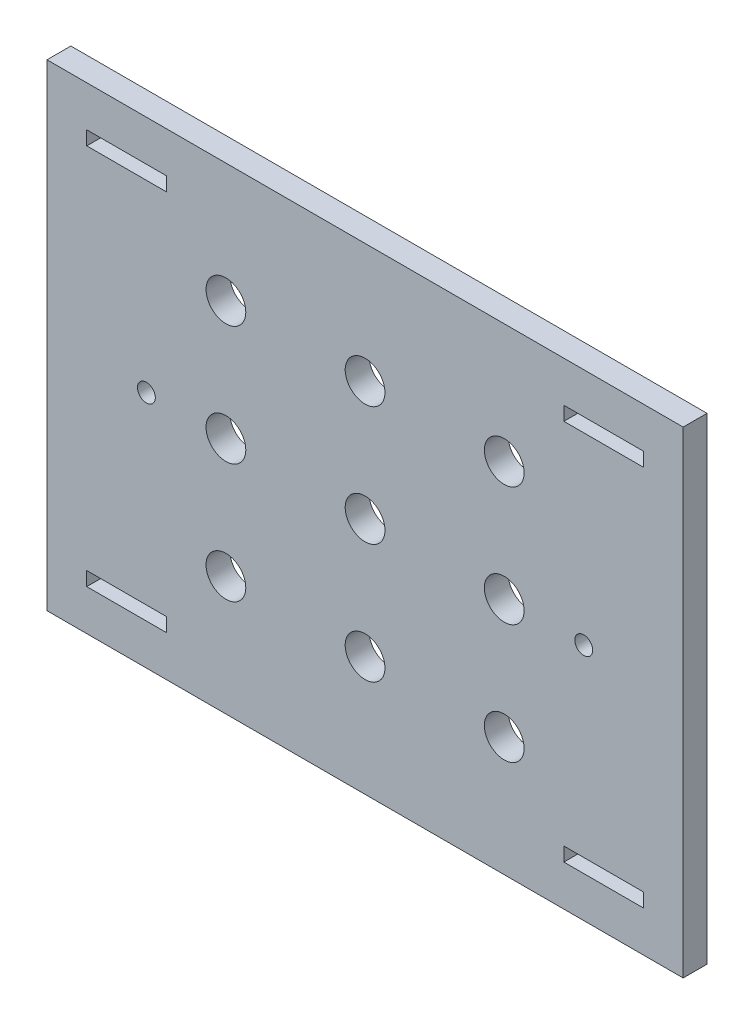
from build123d import *

# Parameters (mm, degrees)
SKETCH_1_W                 = 160
SKETCH_1_H                 = 120
EXTRUDE_160X120_DEPTH      = 6
CUT_EXTRUDE_392_DEPTH      = 101.179838291
CUT_EXTRUDE_392_DEPTH_BACK = 101.179838291
SKETCH_2_R                 = 2.25
SKETCH_2_R_2               = 5
SKETCH_2_W                 = 20
SKETCH_2_H                 = 3.5


with BuildPart() as part:
    # 草图1 → 主板通用托盘160x120 (new body)
    with BuildSketch(Plane.XY):
        Rectangle(SKETCH_1_W, SKETCH_1_H)
    extrude(amount=EXTRUDE_160X120_DEPTH)

    # 草图2 → Cut-Extrude 392 (cut, two sides: drawn at the far end of the back side and taken through both)
    with BuildSketch(Plane.XY.offset(-CUT_EXTRUDE_392_DEPTH_BACK)):
        with Locations((-55, 0)):
            Circle(SKETCH_2_R)
        with Locations((55, 0)):
            Circle(SKETCH_2_R)
        with Locations((-35, -30)):
            Circle(SKETCH_2_R_2)
        with Locations((-35, 0)):
            Circle(SKETCH_2_R_2)
        with Locations((-35, 30)):
            Circle(SKETCH_2_R_2)
        with Locations((0, -30)):
            Circle(SKETCH_2_R_2)
        Circle(SKETCH_2_R_2)
        with Locations((0, 30)):
            Circle(SKETCH_2_R_2)
        with Locations((35, -30)):
            Circle(SKETCH_2_R_2)
        with Locations((35, 0)):
            Circle(SKETCH_2_R_2)
        with Locations((35, 30)):
            Circle(SKETCH_2_R_2)
        with Locations((-60, -48)):
            Rectangle(SKETCH_2_W, SKETCH_2_H)
        with Locations((-60, 48)):
            Rectangle(SKETCH_2_W, SKETCH_2_H)
        with Locations((60, -48)):
            Rectangle(SKETCH_2_W, SKETCH_2_H)
        with Locations((60, 48)):
            Rectangle(SKETCH_2_W, SKETCH_2_H)
    extrude(amount=CUT_EXTRUDE_392_DEPTH + CUT_EXTRUDE_392_DEPTH_BACK, mode=Mode.SUBTRACT)


solid = part.part
